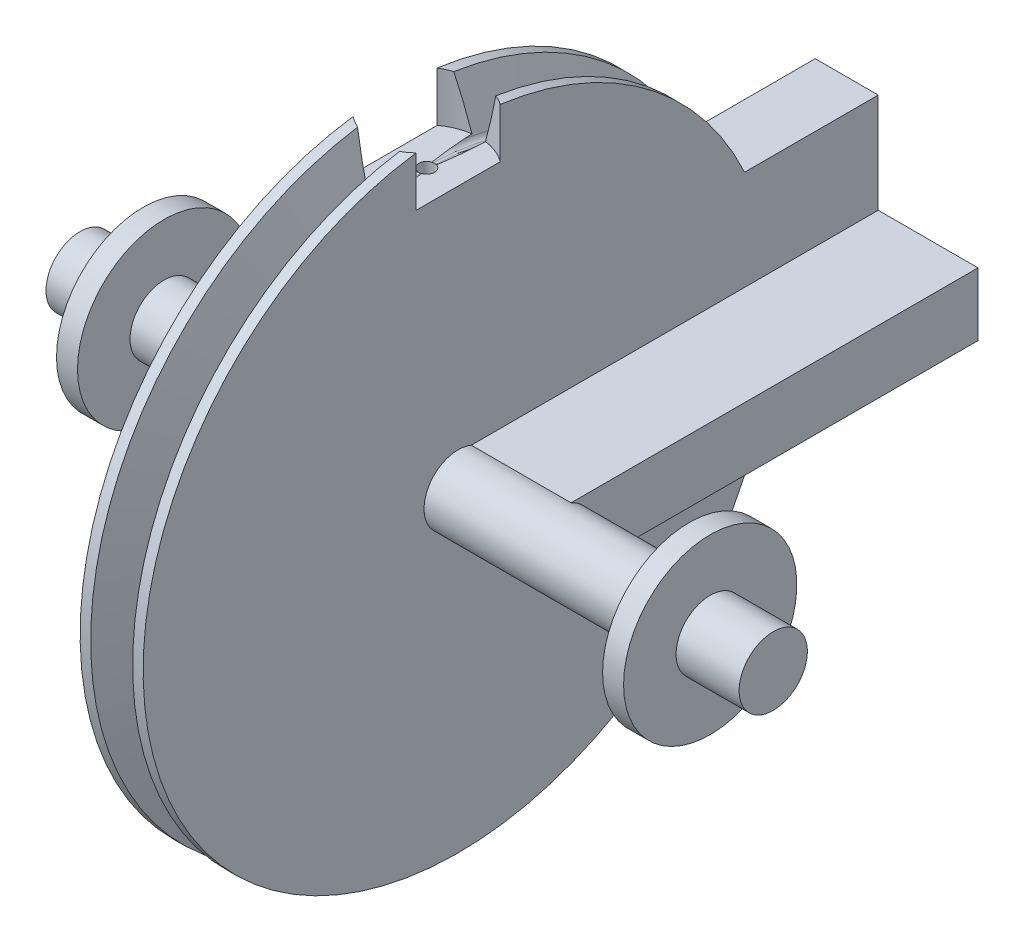
from build123d import *

# Parameters (mm, degrees)
FILLET3_R                = 0.5
BOSS_EXTRUDE1_DEPTH      = 3
BOSS_EXTRUDE1_DEPTH_BACK = 3
SKETCH2_W                = 40
SKETCH2_H                = 25
BOSS_EXTRUDE2_DEPTH      = 3
BOSS_EXTRUDE2_DEPTH_BACK = 3
SKETCH3_W                = 25
SKETCH3_H                = 40
SKETCH4_R                = 0.5
CUT_EXTRUDE1_DEPTH       = 3
SKETCH5_R                = 0.75
CUT_EXTRUDE2_DEPTH       = 10
SKETCH6_R                = 5
CUT_EXTRUDE3_DEPTH       = 76.591004882


with BuildPart() as part:
    # Sketch1 → Revolve1 (revolve)
    with BuildSketch(Plane.XY, mode=Mode.PRIVATE) as revolve1_sk:
        Polygon((-33, 0), (33, 0), (33, 3.25), (27, 3.25), (27, 8.25), (25, 8.25), (25, 3.25), (3, 3.25), (3, 30), (2, 30), (0.5, 25), (-0.5, 25), (-2, 30), (-3, 30), (-3, 3.25), (-25, 3.25), (-25, 8.25), (-27, 8.25), (-27, 3.25), (-33, 3.25), align=None)
    revolve(revolve1_sk.sketch.rotate(Axis((-33, 0, 0), (1, 0, 0)), 90), axis=Axis((-33, 0, 0), (1, 0, 0)))

    # Fillet3
    fillet3_edges = [part.edges().sort_by_distance(p)[0] for p in [
        (0.5, 0, -25),
        (-0.5, 0, -25),
    ]]
    fillet(fillet3_edges, radius=FILLET3_R)

    # Sketch2 → Boss-Extrude1 (add, two sides: drawn at the far end of the back side and taken through both)
    with BuildSketch(Plane(origin=(0, 0, 0), x_dir=(0, 0, -1), z_dir=(1, 0, 0)).offset(-BOSS_EXTRUDE1_DEPTH_BACK)):
        with Locations((20, 0)):
            Rectangle(SKETCH2_W, SKETCH2_H)
    extrude(amount=BOSS_EXTRUDE1_DEPTH + BOSS_EXTRUDE1_DEPTH_BACK)

    # Sketch3 → Boss-Extrude2 (add, two sides: drawn at the far end of the back side and taken through both)
    with BuildSketch(Plane(origin=(0, 0, 0), x_dir=(1, 0, 0), z_dir=(0, 1, 0)).offset(-BOSS_EXTRUDE2_DEPTH_BACK)):
        with Locations((0, 20)):
            Rectangle(SKETCH3_W, SKETCH3_H)
    extrude(amount=BOSS_EXTRUDE2_DEPTH + BOSS_EXTRUDE2_DEPTH_BACK)

    # Sketch4 → Cut-Extrude1 (cut)
    with BuildSketch(Plane(origin=(0, 0, -40), x_dir=(-1, 0, 0), z_dir=(0, 0, -1))):
        with Locations((7, 0)):
            Circle(SKETCH4_R)
        with Locations((-7, 0)):
            Circle(SKETCH4_R)
        with Locations((0, 7)):
            Circle(SKETCH4_R)
        with Locations((0, -7)):
            Circle(SKETCH4_R)
    extrude(amount=-CUT_EXTRUDE1_DEPTH, mode=Mode.SUBTRACT)

    # Sketch5 → Cut-Extrude2 (cut)
    with BuildSketch(Plane(origin=(0, 25, 0), x_dir=(1, 0, 0), z_dir=(0, 1, 0))):
        with Locations(Location((0, 0, 0), (0, 0, 270))):
            Circle(SKETCH5_R)
    extrude(amount=-CUT_EXTRUDE2_DEPTH, mode=Mode.SUBTRACT)

    # Sketch6 → Cut-Extrude3 (cut, through all)
    with BuildSketch(Plane(origin=(0, 25, 0), x_dir=(1, 0, 0), z_dir=(0, 1, 0))):
        Circle(SKETCH6_R)
    extrude(amount=CUT_EXTRUDE3_DEPTH, mode=Mode.SUBTRACT)


solid = part.part
